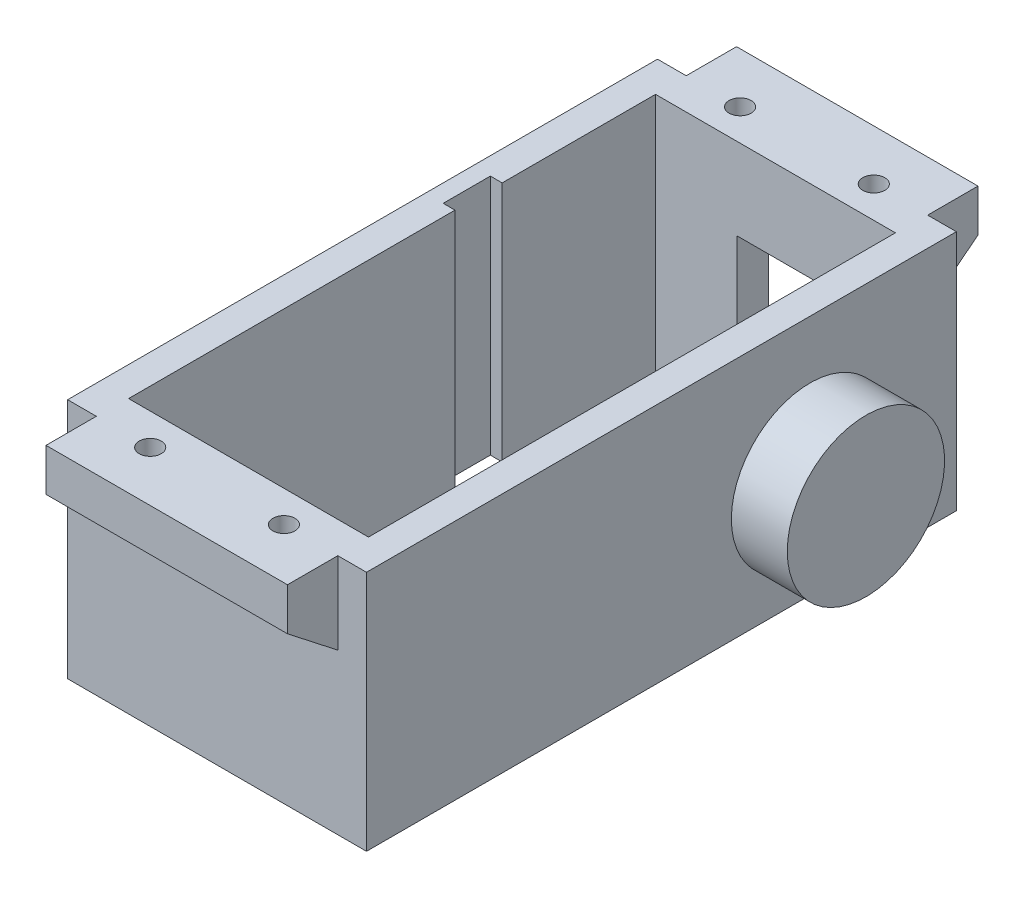
from build123d import *

# Parameters (mm, degrees)
SKETCH_1_W          = 38
SKETCH_1_H          = 75
EXTRUDE_1_DEPTH     = 30.73
SKETCH_2_R          = 10
EXTRUDE_2_DEPTH     = 7.11
SKETCH_3_W          = 30.7
SKETCH_3_H          = 10.4
EXTRUDE_3_DEPTH     = 6.4
SKETCH_5_W          = 30.5
SKETCH_5_H          = 67
CUT_EXTRUDE_1_DEPTH = 60.609353293
CUT_EXTRUDE_2_REACH = 87.153
SKETCH_6_W          = 9.8
SKETCH_6_H          = 20.33
CUT_EXTRUDE_3_REACH = 69.753
SKETCH_8_R          = 1.4
CUT_EXTRUDE_4_DEPTH = 7.4
SKETCH_10_W         = 6
SKETCH_10_H         = 30.73
CUT_EXTRUDE_5_DEPTH = 1.5


with BuildPart() as part:
    # 草图1 → 凸台-拉伸1 (new body)
    with BuildSketch(Plane(origin=(0, 0, 0), x_dir=(1, 0, 0), z_dir=(0, 1, 0))):
        Rectangle(SKETCH_1_W, SKETCH_1_H)
    extrude(amount=EXTRUDE_1_DEPTH)

    # 草图2 → 凸台-拉伸2 (add)
    with BuildSketch(Plane.ZY.offset(19)):
        with Locations(Location((-18.89, 13.38, 0), (0, 0, 180))):
            Circle(SKETCH_2_R)
    extrude_2 = extrude(amount=EXTRUDE_2_DEPTH)

    # 草图3 → 凸台-拉伸3 (add)
    with BuildSketch(Plane(origin=(0, 0, -37.5), x_dir=(-1, 0, 0), z_dir=(0, 0, -1))):
        with Locations((0, 25.53)):
            Rectangle(SKETCH_3_W, SKETCH_3_H)
    extrude_3 = extrude(amount=EXTRUDE_3_DEPTH)

    # 草图5 → 切除-拉伸1 (cut, through all)
    with BuildSketch(Plane(origin=(0, 30.73, 0), x_dir=(1, 0, 0), z_dir=(0, 1, 0))):
        Rectangle(SKETCH_5_W, SKETCH_5_H)
    extrude(amount=-CUT_EXTRUDE_1_DEPTH, mode=Mode.SUBTRACT)

    # 镜向2: 凸台-拉伸2 across plane
    add(extrude_2.mirror(Plane(origin=(0, 0, 0), x_dir=(0, 0, 1), z_dir=(1, 0, 0))))

    # 草图6 → 切除-拉伸2 (cut, up to next)
    with BuildSketch(Plane(origin=(0, 0, -37.5), x_dir=(-1, 0, 0), z_dir=(0, 0, -1)), mode=Mode.PRIVATE) as cut_extrude_2_sk1:
        with Locations((0, 10.165)):
            Rectangle(SKETCH_6_W, SKETCH_6_H)
    cut_extrude_2_tool1 = extrude(cut_extrude_2_sk1.sketch, amount=-CUT_EXTRUDE_2_REACH, mode=Mode.PRIVATE) & part.part
    add(cut_extrude_2_tool1.solids().sort_by_distance((0, 10.165, -37.5))[0], mode=Mode.SUBTRACT)

    # 草图7 → 切除-拉伸3 (cut, up to next)
    with BuildSketch(Plane(origin=(15.35, 0, 0), x_dir=(0, 0, -1), z_dir=(1, 0, 0)), mode=Mode.PRIVATE) as cut_extrude_3_sk1:
        Polygon((37.5, 20.33), (43.9, 25.33022801), (43.9, 20.33), align=None)
    cut_extrude_3_tool1 = extrude(cut_extrude_3_sk1.sketch, amount=-CUT_EXTRUDE_3_REACH, mode=Mode.PRIVATE) & part.part
    cut_extrude_3 = cut_extrude_3_tool1.solids().sort_by_distance((15.35, 21.996743, -41.766667))[0]
    add(cut_extrude_3, mode=Mode.SUBTRACT)

    # 镜向4: 凸台-拉伸3, 切除-拉伸3 across plane
    add(extrude_3.mirror(Plane.XY))
    add(cut_extrude_3.mirror(Plane.XY), mode=Mode.SUBTRACT)

    # 草图8 → 切除-拉伸4 (cut)
    with BuildSketch(Plane(origin=(0, 30.73, 0), x_dir=(1, 0, 0), z_dir=(0, 1, 0))):
        with Locations(Location((-8.5, 37.5, 0), (0, 0, 270))):
            Circle(SKETCH_8_R)
        with Locations(Location((8.5, 37.5, 0), (0, 0, 90))):
            Circle(SKETCH_8_R)
        with Locations(Location((8.5, -37.5, 0), (0, 0, 270))):
            Circle(SKETCH_8_R)
        with Locations(Location((-8.5, -37.5, 0), (0, 0, 90))):
            Circle(SKETCH_8_R)
    extrude(amount=-CUT_EXTRUDE_4_DEPTH, mode=Mode.SUBTRACT)

    # 草图10 → 切除-拉伸5 (cut)
    with BuildSketch(Plane(origin=(-15.25, 0, 0), x_dir=(0, 0, -1), z_dir=(1, 0, 0))):
        with Locations((11, 15.365)):
            Rectangle(SKETCH_10_W, SKETCH_10_H)
    extrude(amount=-CUT_EXTRUDE_5_DEPTH, mode=Mode.SUBTRACT)


solid = part.part
